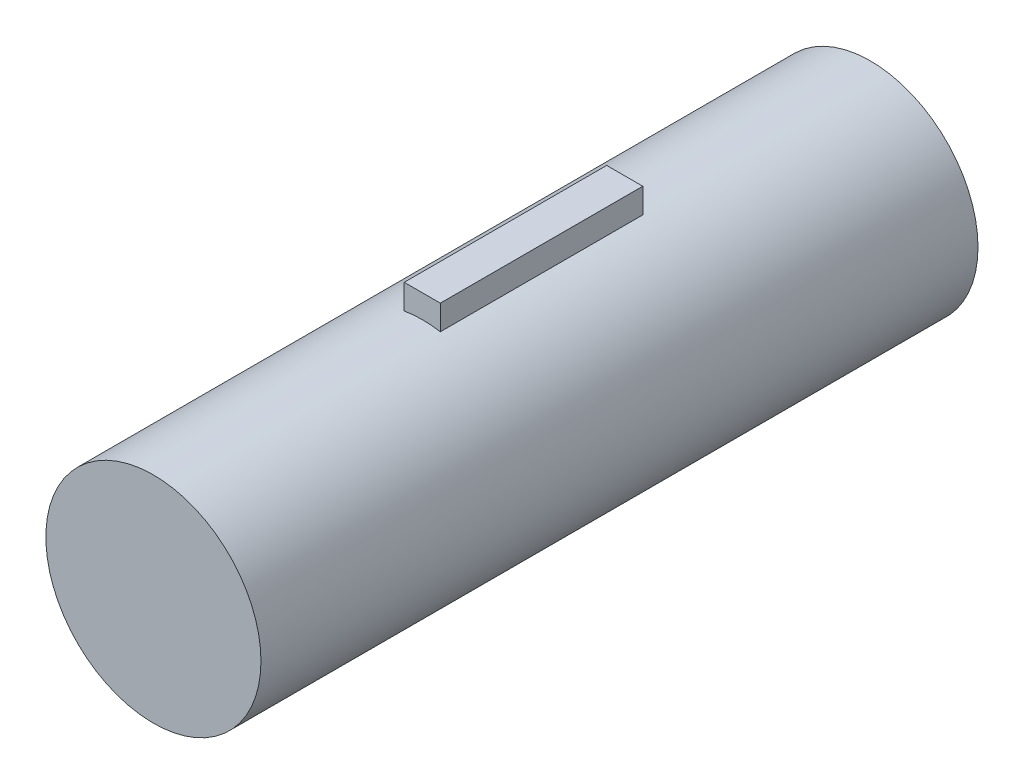
from build123d import *

# Parameters (mm, degrees)
SKETCH1_R           = 6
BOSS_EXTRUDE1_DEPTH = 40
BOSS_EXTRUDE2_DEPTH = 1.3
BOSS_EXTRUDE3_START = -0.085027
BOSS_EXTRUDE3_DEPTH = 0.085027


with BuildPart() as part:
    # Sketch1 → Boss-Extrude1 (new body)
    with BuildSketch(Plane.XY):
        Circle(SKETCH1_R)
    extrude(amount=-BOSS_EXTRUDE1_DEPTH)



with BuildPart() as body_2:
    # Sketch3 → Boss-Extrude2 (new body)
    with BuildSketch(Plane(origin=(0, 6, 0), x_dir=(-1, 0, 0), z_dir=(0, 1, 0))):
        Polygon((0, -14.998657747), (-1.006524795, -14.998657747), (-1.006524795, -26.292665591), (0, -26.292665591), (1.006524795, -26.292665591), (1.006524795, -14.998657747), align=None)
    extrude(amount=BOSS_EXTRUDE2_DEPTH)


with BuildPart() as part_1:
    add(part.part)

    add(body_2.part)  # Boss-Extrude3 merges body 2
    # Sketch3<2> → Boss-Extrude3 (add)
    with BuildSketch(Plane(origin=(0, 6, 0), x_dir=(-1, 0, 0), z_dir=(0, 1, 0)).offset(BOSS_EXTRUDE3_START)):
        Polygon((0, -14.998657747), (-1.006524795, -14.998657747), (-1.006524795, -26.292665591), (0, -26.292665591), (1.006524795, -26.292665591), (1.006524795, -14.998657747), align=None)
    extrude(amount=BOSS_EXTRUDE3_DEPTH)


solid = part_1.part
